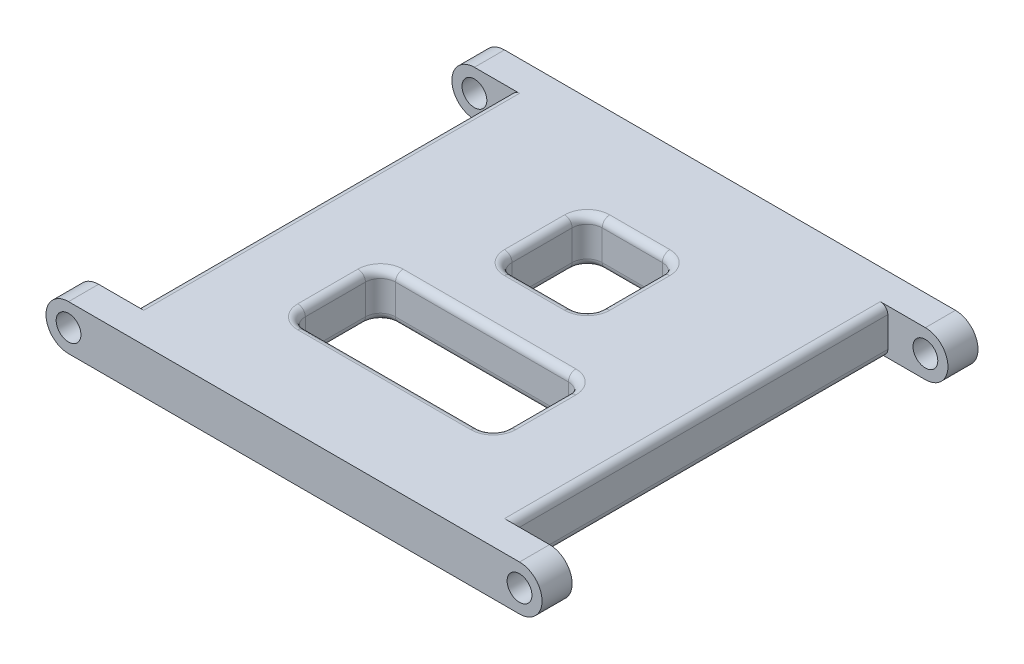
from build123d import *

# Parameters (mm, degrees)
SKETCH1_R           = 1.65
BOSS_EXTRUDE1_DEPTH = 4
BOSS_EXTRUDE2_DEPTH = 25
CUT_EXTRUDE1_DEPTH  = 25
FILLET1_R           = 1


with BuildPart() as part:
    # Sketch1 → Boss-Extrude1 (new body)
    with BuildSketch(Plane.XY):
        with BuildLine():
            ThreePointArc((0, 3), (-3, 0), (0, -3))
            Line((0, -3), (60, -3))
            ThreePointArc((60, -3), (63, 0), (60, 3))
            Line((60, 3), (0, 3))
        make_face()
        Circle(SKETCH1_R, mode=Mode.SUBTRACT)
        with Locations((60, 0)):
            Circle(SKETCH1_R, mode=Mode.SUBTRACT)
    extrude(amount=BOSS_EXTRUDE1_DEPTH)

    # Sketch2 → Boss-Extrude2 (add)
    with BuildSketch(Plane.XY.offset(4)):
        Polygon((55, -2.5), (5, 2.5), (5, -3), (55, -3), align=None)
        Polygon((5, 3), (5, 2.5), (55, -2.5), (55, 3), align=None)
    extrude(amount=BOSS_EXTRUDE2_DEPTH)

    # Mirror1: part across plane


with BuildPart() as part_1:
    add(part.part)
    add(part.part.mirror(Plane.XY.offset(29)))

    # Sketch4 → Cut-Extrude1 (cut)
    with BuildSketch(Plane.XZ.offset(3)):
        with BuildLine():
            Line((16.5, 42.5), (26, 33))
            Line((26, 33), (41.5, 33))
            ThreePointArc((41.5, 33), (42.914213562, 33.585786438), (43.5, 35))
            Line((43.5, 35), (43.5, 43))
            ThreePointArc((43.5, 43), (42.914213562, 44.414213562), (41.5, 45))
            Line((41.5, 45), (18.5, 45))
            ThreePointArc((18.5, 45), (17.085786438, 44.414213562), (16.5, 43))
            Line((16.5, 43), (16.5, 42.5))
        make_face()
        with BuildLine():
            Line((18.5, 33), (26, 33))
            Line((26, 33), (16.5, 42.5))
            Line((16.5, 42.5), (16.5, 35))
            ThreePointArc((16.5, 35), (17.085786438, 33.585786438), (18.5, 33))
        make_face()
        with BuildLine():
            Line((36, 23), (34, 25))
            Line((34, 25), (26, 25))
            ThreePointArc((26, 25), (24.585786438, 24.414213562), (24, 23))
            Line((24, 23), (24, 15))
            ThreePointArc((24, 15), (24.585786438, 13.585786438), (26, 13))
            Line((26, 13), (34, 13))
            ThreePointArc((34, 13), (35.414213562, 13.585786438), (36, 15))
            Line((36, 15), (36, 23))
        make_face()
        with BuildLine():
            ThreePointArc((36, 23), (35.414213562, 24.414213562), (34, 25))
            Line((34, 25), (36, 23))
        make_face()
    extrude(amount=-CUT_EXTRUDE1_DEPTH, mode=Mode.SUBTRACT)

    # Fillet1
    fillet1_edges = [part_1.edges().sort_by_distance(p)[0] for p in [
        (24.585786438, -3, 13.585786438),
        (30, -3, 25),
        (36, -3, 19),
        (30, -3, 13),
        (35.414213562, -3, 13.585786438),
        (35.414213562, -3, 24.414213562),
        (24.585786438, -3, 24.414213562),
        (24, -3, 19),
        (55, -3, 29),
        (55, 3, 29),
        (5, 3, 29),
        (5, -3, 29),
        (30, 3, 13),
        (35.414213562, 3, 13.585786438),
        (36, 3, 19),
        (35.414213562, 3, 24.414213562),
        (30, 3, 25),
        (24.585786438, 3, 24.414213562),
        (24, 3, 19),
        (24.585786438, 3, 13.585786438),
        (17.085786438, 3, 44.414213562),
        (16.5, 3, 39),
        (17.085786438, 3, 33.585786438),
        (30, 3, 33),
        (42.914213562, 3, 33.585786438),
        (43.5, 3, 39),
        (42.914213562, 3, 44.414213562),
        (30, 3, 45),
        (30, -3, 45),
        (43.5, -3, 39),
        (42.914213562, -3, 33.585786438),
        (17.085786438, -3, 33.585786438),
        (17.085786438, -3, 44.414213562),
        (16.5, -3, 39),
        (30, -3, 33),
        (42.914213562, -3, 44.414213562),
    ]]
    fillet(fillet1_edges, radius=FILLET1_R)


solid = part_1.part
